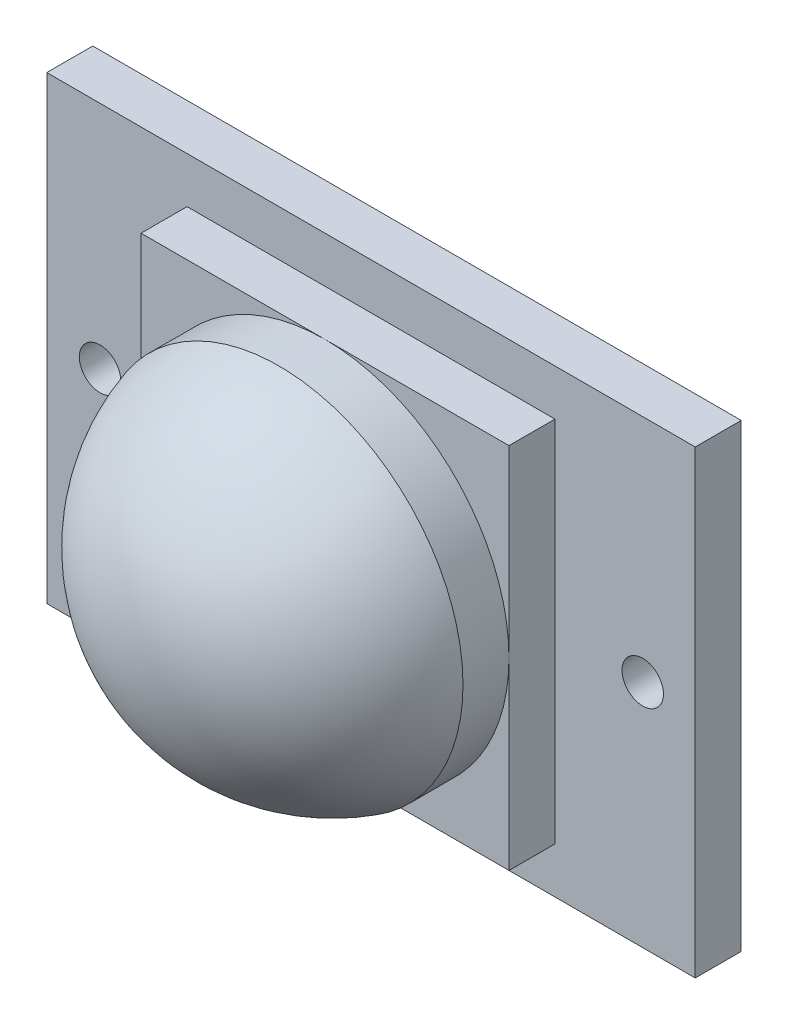
from build123d import *

# Parameters (mm, degrees)
SKETCH1_W           = 35.814
SKETCH1_H           = 25.4
BOSS_EXTRUDE1_DEPTH = 2.54
SKETCH2_R           = 1.143
CUT_EXTRUDE1_DEPTH  = 2.54
SKETCH3_W           = 20.32
SKETCH3_H           = 20.32
BOSS_EXTRUDE3_DEPTH = 2.54
SKETCH4_R           = 10.16
BOSS_EXTRUDE4_DEPTH = 2.54
DOME3_FACE_RADIUS   = 10.16
DOME3_HEIGHT        = 7.62


with BuildPart() as part:
    # Sketch1 → Boss-Extrude1 (new body)
    with BuildSketch(Plane.XY):
        with Locations((17.907, 12.7)):
            Rectangle(SKETCH1_W, SKETCH1_H)
    extrude(amount=BOSS_EXTRUDE1_DEPTH)

    # Sketch2 → Cut-Extrude1 (cut)
    with BuildSketch(Plane.XY.offset(2.54)):
        with Locations((2.942, 12.7)):
            Circle(SKETCH2_R)
        with Locations((32.914, 12.7)):
            Circle(SKETCH2_R)
    extrude(amount=-CUT_EXTRUDE1_DEPTH, mode=Mode.SUBTRACT)

    # Sketch3 → Boss-Extrude3 (add)
    with BuildSketch(Plane.XY.offset(2.54)):
        with Locations((17.907, 12.7)):
            Rectangle(SKETCH3_W, SKETCH3_H)
    extrude(amount=BOSS_EXTRUDE3_DEPTH)

    # Sketch4 → Boss-Extrude4 (add)
    with BuildSketch(Plane.XY.offset(5.08)):
        with Locations((17.907, 12.7)):
            Circle(SKETCH4_R)
    extrude(amount=BOSS_EXTRUDE4_DEPTH)

    # Dome3: a dome of height H over a round flat face of radius A is a cap of a sphere of radius (A * A + H * H) / (2 * H)
    dome3_r = (DOME3_FACE_RADIUS * DOME3_FACE_RADIUS + DOME3_HEIGHT * DOME3_HEIGHT) / (2 * DOME3_HEIGHT)
    dome3_base = Plane((17.907, 12.7, 7.62), z_dir=(0, 0, 1))
    with Locations(dome3_base.offset(DOME3_HEIGHT - dome3_r)):
        dome3_ball = Sphere(dome3_r, mode=Mode.PRIVATE)
    add(split(dome3_ball, bisect_by=dome3_base, keep=Keep.TOP, mode=Mode.PRIVATE))


solid = part.part
